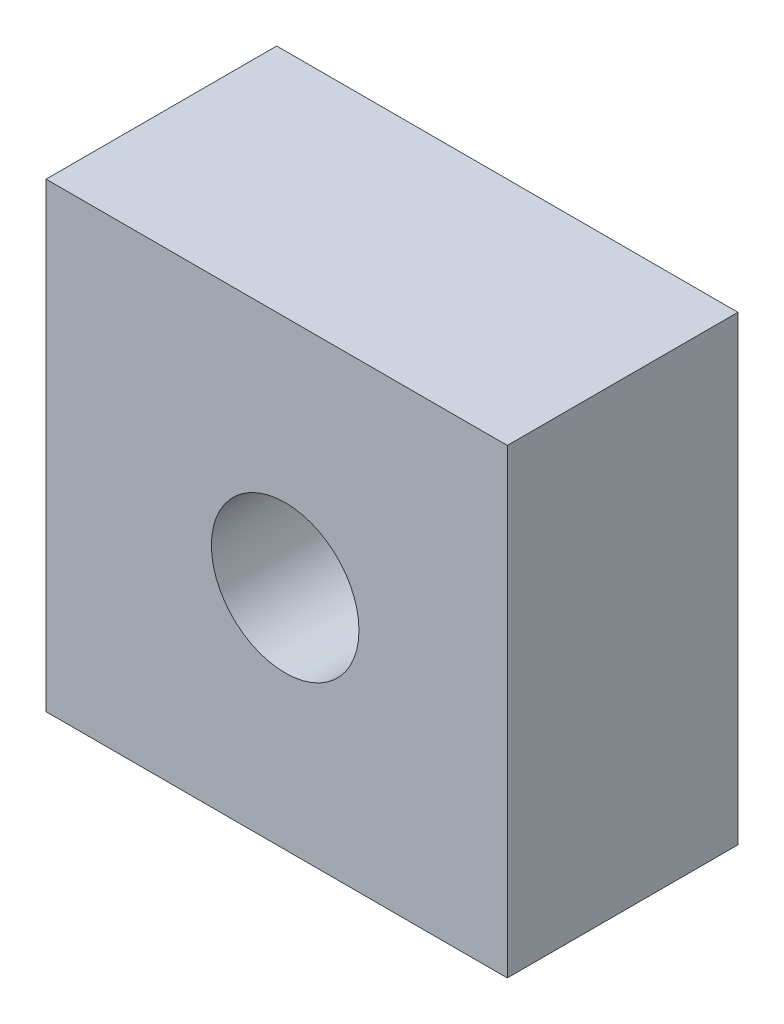
from build123d import *

# Parameters (mm, degrees)
SKETCH1_W           = 100
SKETCH1_H           = 50
BOSS_EXTRUDE1_DEPTH = 100
SKETCH2_R           = 16
CUT_EXTRUDE1_DEPTH  = 100


with BuildPart() as part:
    # Sketch1 → Boss-Extrude1 (new body)
    with BuildSketch(Plane(origin=(0, 0, 0), x_dir=(1, 0, 0), z_dir=(0, 1, 0))):
        with Locations((50, -25)):
            Rectangle(SKETCH1_W, SKETCH1_H)
    extrude(amount=BOSS_EXTRUDE1_DEPTH)

    # Sketch2 → Cut-Extrude1 (cut)
    with BuildSketch(Plane(origin=(0, 0, 0), x_dir=(-1, 0, 0), z_dir=(0, 0, -1))):
        with Locations((-51.840402326, 49.198763907)):
            Circle(SKETCH2_R)
    extrude(amount=-CUT_EXTRUDE1_DEPTH, mode=Mode.SUBTRACT)


solid = part.part
